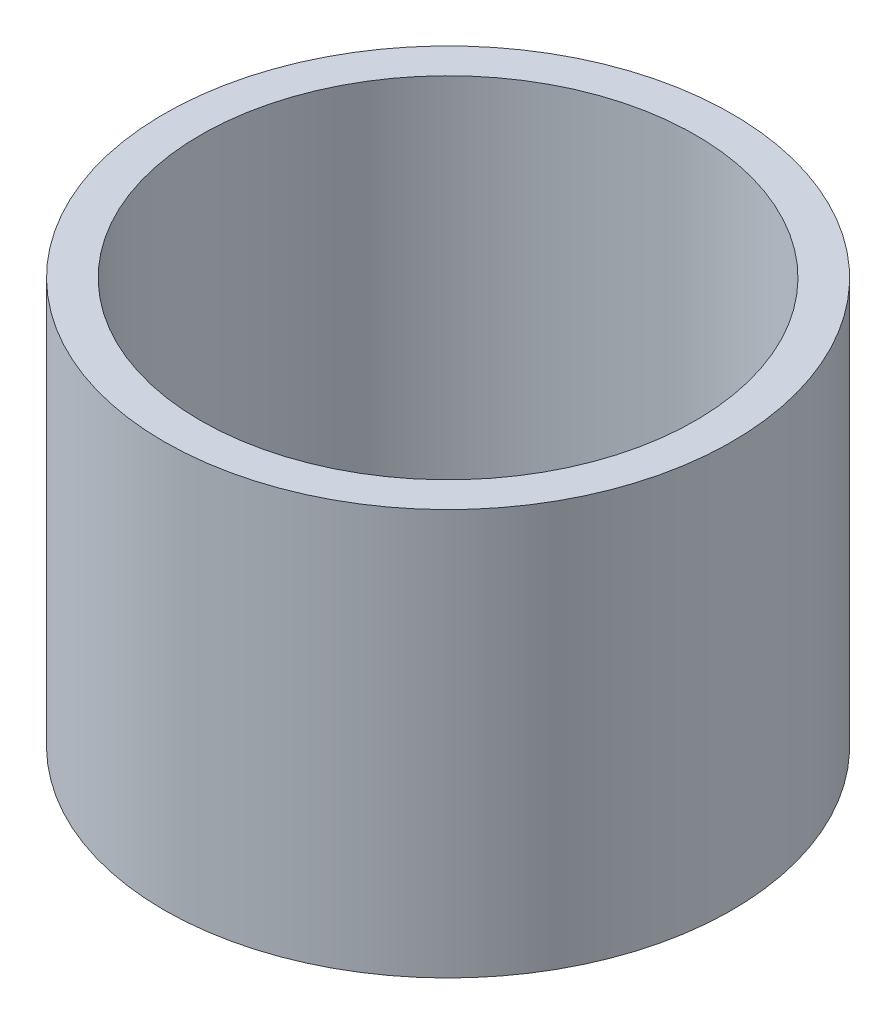
from build123d import *

# Parameters (mm, degrees)
SKETCH1_R           = 3.5
SKETCH1_R_2         = 3.05
BOSS_EXTRUDE1_DEPTH = 5


with BuildPart() as part:
    # Sketch1 → Boss-Extrude1 (new body)
    with BuildSketch(Plane(origin=(0, 0, 0), x_dir=(1, 0, 0), z_dir=(0, 1, 0))):
        with Locations(Location((0, 0, 0), (0, 0, 270))):
            Circle(SKETCH1_R)
        with Locations(Location((0, 0, 0), (0, 0, 270))):
            Circle(SKETCH1_R_2, mode=Mode.SUBTRACT)
    extrude(amount=BOSS_EXTRUDE1_DEPTH)


solid = part.part
